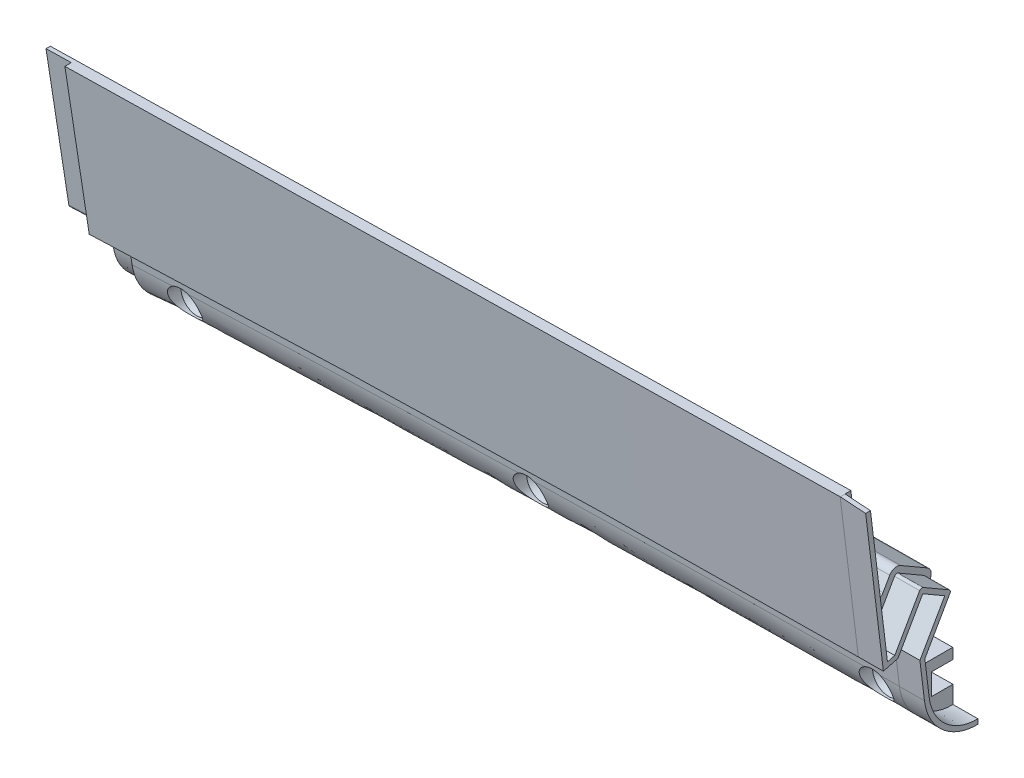
from build123d import *


with BuildPart() as part:
    # Sweep3: sweep along a path in Sketch3
    with BuildLine(Plane.XY.offset(101.6)) as sweep3_path:
        ThreePointArc((622.103936151, -83.199836272), (0, -43.636564626), (-622.103936151, -83.199836272))
    # Sketch4 → Sweep3 (sweep)
    with BuildSketch(Plane(origin=(-117.330566703, 4.430423936, 1117.6), x_dir=(0, 0, -1), z_dir=(0.9994536405585157, 0.03305178322465143, 0))):
        with BuildLine():
            Line((991.529482971, -5.453775083), (988.971801376, -5.453775083))
            Line((988.971801376, -5.453775083), (993.32506615, -42.283775083))
            Line((993.32506615, -42.283775083), (996.794703229, -41.354088728))
            Line((996.794703229, -41.354088728), (1002.763703229, -31.015013775))
            Line((1002.763703229, -31.015013775), (1007.999, -34.037749136))
            Line((1007.999, -34.037749136), (1002.03, -44.376824659))
            Line((1002.03, -44.376824659), (1003.077032208, -53.235049058))
            ThreePointArc((1003.077032208, -53.235049058), (1007.29752688, -61.276835992), (1015.8095, -64.443731312))
            Line((1015.8095, -64.443731312), (1015.8095, -59.12218153))
            Line((1015.8095, -59.12218153), (1010.7295, -59.12218153))
            Line((1010.7295, -59.12218153), (1010.7295, -54.041969025))
            Line((1010.7295, -54.041969025), (1015.8095, -54.041969025))
            Line((1015.8095, -54.041969025), (1015.8095, -51.501969025))
            Line((1015.8095, -51.501969025), (1007.687322123, -51.501969025))
            ThreePointArc((1007.687322123, -51.501969025), (1005.99997215, -50.860507955), (1005.164881483, -49.260118685))
            Line((1005.164881483, -49.260118685), (1004.750455768, -45.75394576))
            ThreePointArc((1004.750455768, -45.75394576), (1004.7850335, -44.943801809), (1005.073167189, -44.18583887))
            Line((1005.073167189, -44.18583887), (1010.516206197, -34.757795418))
            ThreePointArc((1010.516206197, -34.757795418), (1010.706497969, -33.312277166), (1009.818941274, -32.155567572))
            Line((1009.818941274, -32.155567572), (1003.483804566, -28.49781089))
            ThreePointArc((1003.483804566, -28.49781089), (1002.038222268, -28.307482122), (1000.881475684, -29.195102853))
            Line((1000.881475684, -29.195102853), (999.272416391, -31.982200293))
            ThreePointArc((999.272416391, -31.982200293), (996.560692883, -33.200105913), (994.550246564, -31.010392672))
            Line((994.550246564, -31.010392672), (991.529482971, -5.453775083))
        make_face()
    sweep(path=sweep3_path.line)

    # SurfaceCut1
    split(bisect_by=Plane(origin=(-211.442164364, -9.040193423, 0), x_dir=(0.04271589869142412, -0.9990872594518379, 0), z_dir=(-0.9990872594518379, -0.04271589869142412, 0)), keep=Keep.BOTTOM)

    # SurfaceCut2
    split(bisect_by=Plane(origin=(-26.729039131, -0.144205129, 0), x_dir=(-0.005394994920627918, 0.999985446909007, 0), z_dir=(0.999985446909007, 0.005394994920627918, 0)), keep=Keep.BOTTOM)

    # Sketch8 → Cut-Revolve1 (revolve, cut)
    with BuildSketch(Plane(origin=(-117.056038996, -3.871025798, 0), x_dir=(0, 0, -1), z_dir=(0.9994536405585157, 0.03305178322465143, 0)), mode=Mode.PRIVATE) as cut_revolve1_sk:
        Polygon((-119.5705, -48.27608749), (-106.8705, -48.27608749), (-106.8705, -46.37108749), (-108.7755, -46.37108749), (-110.6805, -44.46608749), (-119.5705, -44.46608749), align=None)
    cut_revolve1 = revolve(cut_revolve1_sk.sketch.rotate(Axis((-115.460428217, -52.120737191, 119.5705), (0, 0, -1)), 91.894072645), axis=Axis((-115.460428217, -52.120737191, 119.5705), (0, 0, -1)), mode=Mode.SUBTRACT)

    # Sketch-Pattern1: Cut-Revolve1 at 2 more places
    with Locations((82.543476, 1.248991, 0), (-82.510753, -2.638363, 0)):
        add(cut_revolve1, mode=Mode.SUBTRACT)

    # Sweep4: sweep along a path in Sketch12
    with BuildLine(Plane(origin=(0, 0, 101.7905), x_dir=(-1, 0, 0), z_dir=(0, 0, -1))) as sweep4_path:
        ThreePointArc((26.482977271, -45.7528262), (23.498481614, -45.737631933), (20.513977271, -45.72425223))
    # Sketch11 → Sweep4 (sweep)
    with BuildSketch(Plane(origin=(-26.729039131, -0.144205129, 0), x_dir=(0, 0, -1), z_dir=(0.999985446909007, 0.005394994920627919, 0))):
        with BuildLine():
            Line((-124.27493385, -36.391506102), (-128.628198624, 0.436850373))
            Line((-128.628198624, 0.436850373), (-127.477241199, 0.436850373))
            Line((-127.477241199, 0.436850373), (-123.294888708, -34.945598527))
            Line((-123.294888708, -34.945598527), (-121.558436986, -34.480338654))
            Line((-121.558436986, -34.480338654), (-115.572163807, -24.111809362))
            ThreePointArc((-115.572163807, -24.111809362), (-115.18658777, -23.815946462), (-114.704737676, -23.87938323))
            Line((-114.704737676, -23.87938323), (-108.589559095, -27.40998323))
            ThreePointArc((-108.589559095, -27.40998323), (-108.293696195, -27.795559268), (-108.357132963, -28.277409362))
            Line((-108.357132963, -28.277409362), (-114.390345193, -38.727239476))
            Line((-114.390345193, -38.727239476), (-113.38787021, -47.208113299))
            add(Edge.make_bspline(
                [(-101.801323322, -57.407512783), (-103.201893406, -57.420775688), (-106.035083238, -56.925945831), (-109.715936846, -54.72509392), (-111.931567303, -51.901670972), (-113.005394664, -49.310854806), (-113.304795542, -47.910919584), (-113.38787021, -47.208113299)],
                knots=[0, 0, 0, 0, 0.25, 0.5, 0.75, 0.875, 1, 1, 1, 1], degree=3))
            Line((-101.801323322, -57.407512783), (-101.7905, -57.407512783))
            Line((-101.7905, -57.407512783), (-101.7905, -58.550461537))
            add(Edge.make_bspline(
                [(-101.7905, -58.550461537), (-102.571330027, -58.557855723), (-103.340677537, -58.493740155), (-104.478193263, -58.294775154), (-104.85459633, -58.211209955), (-105.601773783, -58.009025779), (-105.974437358, -57.889651725), (-107.067422067, -57.483074055), (-107.762018779, -57.149167004), (-108.75418736, -56.556539151), (-109.076570448, -56.343605977), (-109.70425095, -55.886209033), (-110.009875034, -55.641180376), (-110.882225451, -54.873559836), (-111.411403795, -54.314280813), (-112.366195112, -53.101758262), (-112.794349261, -52.441787441), (-113.512952594, -51.074019466), (-113.807619255, -50.362850296), (-114.152305696, -49.255016357), (-114.251122313, -48.877642783), (-114.413580033, -48.114634615), (-114.477136038, -47.730020271), (-114.522967792, -47.342286622)],
                knots=[0, 0, 0, 0, 0.125, 0.125, 0.1875, 0.1875, 0.25, 0.25, 0.375, 0.375, 0.4375, 0.4375, 0.5, 0.5, 0.625, 0.625, 0.75, 0.75, 0.875, 0.875, 0.9375, 0.9375, 1, 1, 1, 1], degree=3))
            Line((-114.522967792, -47.342286622), (-115.57, -38.484461537))
            Line((-115.57, -38.484461537), (-109.601, -28.145850267))
            Line((-109.601, -28.145850267), (-114.836296771, -25.123250267))
            Line((-114.836296771, -25.123250267), (-120.805296771, -35.461861537))
            Line((-120.805296771, -35.461861537), (-124.27493385, -36.391506102))
        make_face()
    sweep(path=sweep4_path.line)

    # Sweep5: sweep along a path in Sketch16
    with BuildLine(Plane(origin=(0, 0, 101.7905), x_dir=(-1, 0, 0), z_dir=(0, 0, -1))) as sweep5_path:
        ThreePointArc((215.647406705, -50.42045008), (212.665748146, -50.290245196), (209.684010975, -50.161853153))
    # Sketch15 → Sweep5 (sweep)
    with BuildSketch(Plane(origin=(-211.442164364, -9.040193423, 0), x_dir=(0, 0, 1), z_dir=(-0.9990872594518379, -0.04271589869142412, 0))):
        with BuildLine():
            Line((113.00950435, -42.713331456), (113.97237291, -34.567525415))
            ThreePointArc((113.97237291, -34.567525415), (113.963727961, -34.364981701), (113.891689273, -34.175484686))
            Line((113.891689273, -34.175484686), (107.519177285, -23.137970149))
            Line((107.519177285, -23.137970149), (115.394119486, -18.591370149))
            Line((115.394119486, -18.591370149), (121.677968823, -29.475316467))
            ThreePointArc((121.677968823, -29.475316467), (121.841334284, -29.661598015), (122.06355177, -29.771181218))
            Line((122.06355177, -29.771181218), (122.259394286, -29.823654698))
            ThreePointArc((122.259394286, -29.823654698), (122.780015415, -29.735923875), (123.054347243, -29.284830643))
            Line((123.054347243, -29.284830643), (127.093588723, 4.886907775))
            Line((127.093588723, 4.886907775), (126.070517029, 4.886907775))
            Line((126.070517029, 4.886907775), (123.049753436, -20.668571968))
            add(Edge.make_bspline(
                [(123.049753436, -20.668571968), (123.018406598, -20.933764287), (122.944898871, -21.192703381), (122.72486191, -21.671025374), (122.574983618, -21.89613649), (122.218479429, -22.283693321), (122.006878086, -22.451668909), (121.662818096, -22.646204147), (121.543504304, -22.701961436), (121.295473201, -22.795007288), (121.166493424, -22.832124521), (120.907997451, -22.885096572), (120.777385583, -22.901432856), (120.51342226, -22.913717924), (120.37910716, -22.909438417), (120.116311005, -22.880334184), (119.986998098, -22.855691982), (119.732512188, -22.786374688), (119.606266969, -22.741161694), (119.243601748, -22.578043456), (119.021351761, -22.432970621), (118.626712377, -22.076251458), (118.461102845, -21.871598209), (118.327583609, -21.640336089)],
                knots=[0, 0, 0, 0, 0.125, 0.125, 0.25, 0.25, 0.375, 0.375, 0.4375, 0.4375, 0.5, 0.5, 0.5625, 0.5625, 0.625, 0.625, 0.6875, 0.6875, 0.75, 0.75, 0.875, 0.875, 1, 1, 1, 1], degree=3))
            Line((118.327583609, -21.640336089), (116.718524316, -18.853363359))
            ThreePointArc((116.718524316, -18.853363359), (115.561765682, -17.965779092), (114.116195434, -18.156102576))
            Line((114.116195434, -18.156102576), (107.781058726, -21.813695606))
            ThreePointArc((107.781058726, -21.813695606), (106.893505265, -22.97034131), (107.083793803, -24.415806877))
            Line((107.083793803, -24.415806877), (112.526832811, -33.84342694))
            ThreePointArc((112.526832811, -33.84342694), (112.814966033, -34.601353512), (112.849544232, -35.411463252))
            Line((112.849544232, -35.411463252), (112.435118517, -38.917478209))
            ThreePointArc((112.435118517, -38.917478209), (111.600006373, -40.51781438), (109.912677877, -41.159227425))
            Line((109.912677877, -41.159227425), (101.7905, -41.159227425))
            Line((101.7905, -41.159227425), (101.7905, -43.699112741))
            Line((101.7905, -43.699112741), (106.8705, -43.699112741))
            Line((106.8705, -43.699112741), (106.8705, -48.779095512))
            Line((106.8705, -48.779095512), (101.7905, -48.779095512))
            Line((101.7905, -48.779095512), (101.7905, -52.576472462))
            Line((101.7905, -52.576472462), (101.804931097, -52.576472462))
            add(Edge.make_bspline(
                [(101.804931097, -52.576472462), (102.489279498, -52.582953001), (103.868868527, -52.467414443), (106.485766193, -51.75509811), (109.465837716, -49.976138537), (112.028433947, -46.715360308), (112.850511097, -44.058404026), (113.00950435, -42.713331456)],
                knots=[0, 0, 0, 0, 0.125, 0.25, 0.5, 0.75, 1, 1, 1, 1], degree=3))
        make_face()
    sweep(path=sweep5_path.line)

    # SurfaceCut3
    split(bisect_by=Plane(origin=(0.017601899, -0.946238327, 0), x_dir=(-0.9998270282032494, -0.018598754642685438, 0), z_dir=(0.018598754642685438, -0.9998270282032495, 0)), keep=Keep.TOP)

    # SurfaceCut4
    split(bisect_by=Plane(origin=(-0.281441311, -3.540816628, 0), x_dir=(-0.9968559683834085, 0.07923495629062319, 0), z_dir=(-0.07923495629062319, -0.9968559683834085, 0)), keep=Keep.TOP)


solid = part.part
